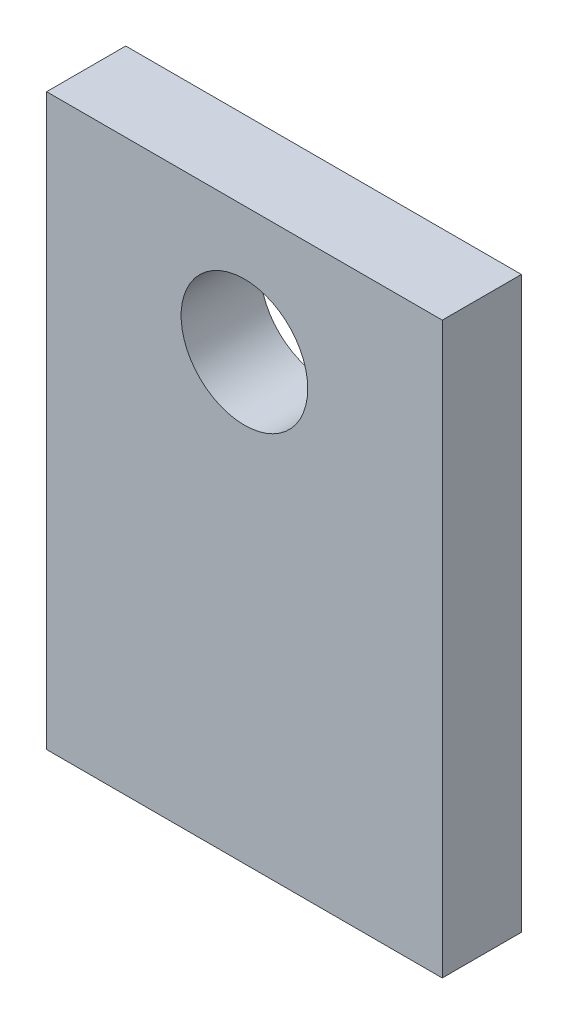
from build123d import *

# Parameters (mm, degrees)
SKETCH1_W          = 125
SKETCH1_H          = 180
SKETCH1_R          = 20
BASE_EXTRUDE_DEPTH = 25


with BuildPart() as part:
    # Sketch1 → Base-Extrude (new body)
    with BuildSketch(Plane.XY):
        with Locations((62.5, 90)):
            Rectangle(SKETCH1_W, SKETCH1_H)
        with Locations((62.5, 140)):
            Circle(SKETCH1_R, mode=Mode.SUBTRACT)
    extrude(amount=BASE_EXTRUDE_DEPTH)


solid = part.part
